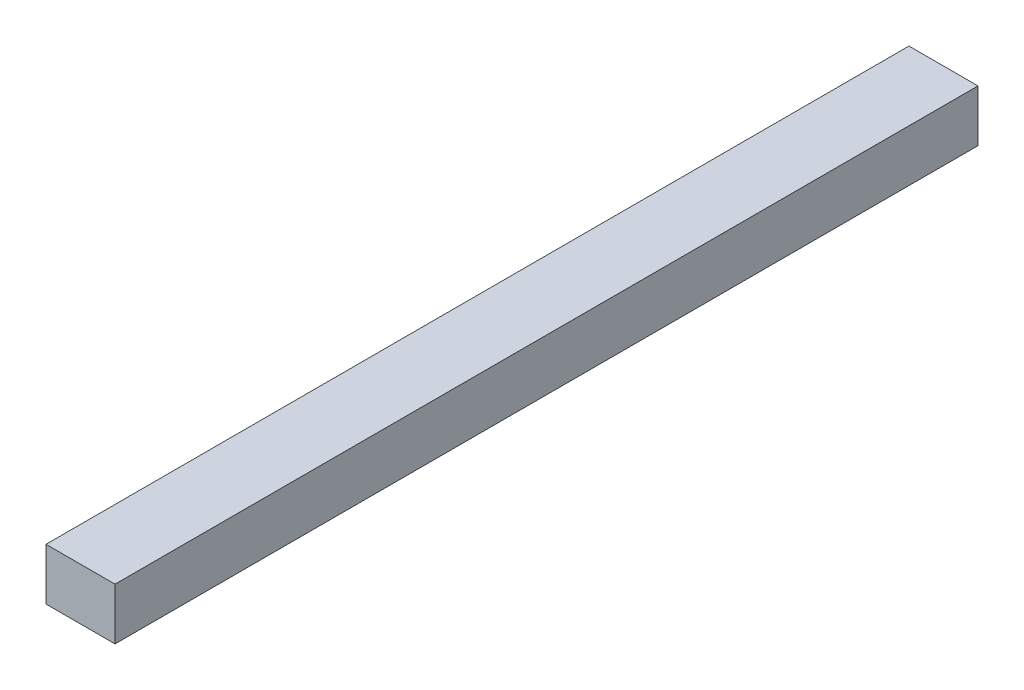
from build123d import *

# Parameters (mm, degrees)
SKETCH_1_W      = 400
SKETCH_1_H      = 300
EXTRUDE_1_DEPTH = 2500


with BuildPart() as part:
    # 草图1 → 凸台-拉伸1 (new, symmetric)
    with BuildSketch(Plane.XY):
        Rectangle(SKETCH_1_W, SKETCH_1_H)
    extrude(amount=EXTRUDE_1_DEPTH, both=True)


solid = part.part
